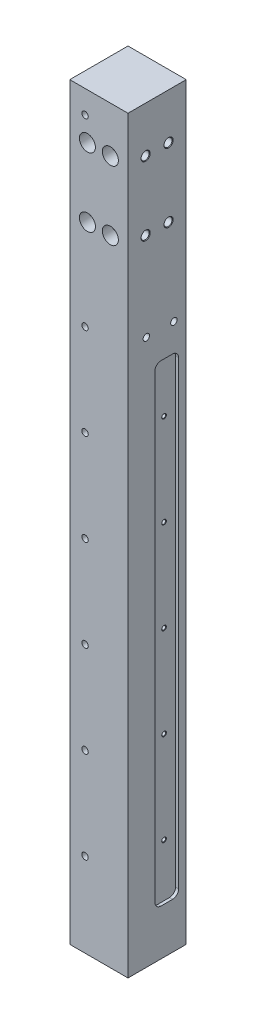
from build123d import *

# Parameters (mm, degrees)
SKETCH1_W                      = 38.1
SKETCH1_H                      = 38.1
BOSS_EXTRUDE1_DEPTH            = 490
CBORE_FOR_M5_SBHCS1_AT_2_COUNT = 2
CBORE_FOR_M5_SBHCS1_AT_2_PITCH = 15
CBORE_FOR_M5_SBHCS1_AT_3_COUNT = 2
CBORE_FOR_M5_SBHCS1_AT_3_PITCH = 45
CBORE_FOR_M5_SBHCS1_AT_4_COUNT = 2
CBORE_FOR_M5_SBHCS1_AT_4_PITCH = 47.434164903
M5X0_8_TAPPED_HOLE1_AT_2_COUNT = 2
M5X0_8_TAPPED_HOLE1_AT_2_PITCH = 60
M5X0_8_TAPPED_HOLE1_AT_3_COUNT = 2
M5X0_8_TAPPED_HOLE1_AT_3_PITCH = 120
M5X0_8_TAPPED_HOLE1_AT_4_COUNT = 2
M5X0_8_TAPPED_HOLE1_AT_4_PITCH = 180
M5X0_8_TAPPED_HOLE1_AT_5_COUNT = 2
M5X0_8_TAPPED_HOLE1_AT_5_PITCH = 240
M5X0_8_TAPPED_HOLE1_AT_6_COUNT = 2
M5X0_8_TAPPED_HOLE1_AT_6_PITCH = 300
M5X0_8_TAPPED_HOLE1_AT_7_COUNT = 2
M5X0_8_TAPPED_HOLE1_AT_7_PITCH = 360
M5X0_8_TAPPED_HOLE1_AT_8_COUNT = 2
M5X0_8_TAPPED_HOLE1_AT_8_PITCH = 420
M5X0_8_TAPPED_HOLE3_AT_2_COUNT = 2
M5X0_8_TAPPED_HOLE3_AT_2_PITCH = 18
SKETCH11_W                     = 15.5
SKETCH11_H                     = 309
CUT_EXTRUDE1_DEPTH             = 2
FILLET1_R                      = 4
M3X0_5_TAPPED_HOLE1_AT_2_COUNT = 2
M3X0_5_TAPPED_HOLE1_AT_2_PITCH = 60
M3X0_5_TAPPED_HOLE1_AT_3_COUNT = 2
M3X0_5_TAPPED_HOLE1_AT_3_PITCH = 120
M3X0_5_TAPPED_HOLE1_AT_4_COUNT = 2
M3X0_5_TAPPED_HOLE1_AT_4_PITCH = 180
M3X0_5_TAPPED_HOLE1_AT_5_COUNT = 2
M3X0_5_TAPPED_HOLE1_AT_5_PITCH = 240
FILLET1_OF_MIRROR2_R           = 4


with BuildPart() as part:
    # Sketch1 → Boss-Extrude1 (new body)
    with BuildSketch(Plane(origin=(0, 0, 0), x_dir=(1, 0, 0), z_dir=(0, 1, 0))):
        Rectangle(SKETCH1_W, SKETCH1_H)
    extrude(amount=BOSS_EXTRUDE1_DEPTH)

    # Sketch3 → CBORE for M5 SBHCS1 (revolve, cut)
    with BuildSketch(Plane(origin=(-19.05, 415, -7.5), x_dir=(0, 0, 1), z_dir=(0, 1, 0))):
        Polygon((0, 0), (0, 38.1), (3, 38.1), (2.65, 37.75), (2.65, 32.85), (5.25, 32.85), (5.25, 0), align=None)
    cbore_for_m5_sbhcs1 = revolve(axis=Axis((-25.4, 415, -7.5), (1, 0, 0)), mode=Mode.SUBTRACT)

    # CBORE for M5 SBHCS1 at 2: CBORE for M5 SBHCS1 ×2
    with Locations(*[(0, 0, i * CBORE_FOR_M5_SBHCS1_AT_2_PITCH) for i in range(1, CBORE_FOR_M5_SBHCS1_AT_2_COUNT)]):
        add(cbore_for_m5_sbhcs1, mode=Mode.SUBTRACT)

    # CBORE for M5 SBHCS1 at 3: CBORE for M5 SBHCS1 ×2
    with Locations(*[(0, i * CBORE_FOR_M5_SBHCS1_AT_3_PITCH, 0) for i in range(1, CBORE_FOR_M5_SBHCS1_AT_3_COUNT)]):
        add(cbore_for_m5_sbhcs1, mode=Mode.SUBTRACT)

    # CBORE for M5 SBHCS1 at 4: CBORE for M5 SBHCS1 ×2
    with Locations(*[Vector(0, 0.9486832980505138, 0.31622776601683833) * (i * CBORE_FOR_M5_SBHCS1_AT_4_PITCH) for i in range(1, CBORE_FOR_M5_SBHCS1_AT_4_COUNT)]):
        add(cbore_for_m5_sbhcs1, mode=Mode.SUBTRACT)

    # Sketch6 → M5x0.8 Tapped Hole1 (revolve, cut)
    with BuildSketch(Plane(origin=(-19.05, 475, 9.05), x_dir=(0, 0, 1), z_dir=(0, 1, 0))):
        Polygon((0, 0), (0, 9.6618073), (2.1, 8.4), (2.1, 0), align=None)
    m5x0_8_tapped_hole1 = revolve(axis=Axis((-25.4, 475, 9.05), (1, 0, 0)), mode=Mode.SUBTRACT)

    # M5x0.8 Tapped Hole1 at 2: M5x0.8 Tapped Hole1 ×2
    with Locations(*[(0, -i * M5X0_8_TAPPED_HOLE1_AT_2_PITCH, 0) for i in range(1, M5X0_8_TAPPED_HOLE1_AT_2_COUNT)]):
        add(m5x0_8_tapped_hole1, mode=Mode.SUBTRACT)

    # M5x0.8 Tapped Hole1 at 3: M5x0.8 Tapped Hole1 ×2
    with Locations(*[(0, -i * M5X0_8_TAPPED_HOLE1_AT_3_PITCH, 0) for i in range(1, M5X0_8_TAPPED_HOLE1_AT_3_COUNT)]):
        add(m5x0_8_tapped_hole1, mode=Mode.SUBTRACT)

    # M5x0.8 Tapped Hole1 at 4: M5x0.8 Tapped Hole1 ×2
    with Locations(*[(0, -i * M5X0_8_TAPPED_HOLE1_AT_4_PITCH, 0) for i in range(1, M5X0_8_TAPPED_HOLE1_AT_4_COUNT)]):
        add(m5x0_8_tapped_hole1, mode=Mode.SUBTRACT)

    # M5x0.8 Tapped Hole1 at 5: M5x0.8 Tapped Hole1 ×2
    with Locations(*[(0, -i * M5X0_8_TAPPED_HOLE1_AT_5_PITCH, 0) for i in range(1, M5X0_8_TAPPED_HOLE1_AT_5_COUNT)]):
        add(m5x0_8_tapped_hole1, mode=Mode.SUBTRACT)

    # M5x0.8 Tapped Hole1 at 6: M5x0.8 Tapped Hole1 ×2
    with Locations(*[(0, -i * M5X0_8_TAPPED_HOLE1_AT_6_PITCH, 0) for i in range(1, M5X0_8_TAPPED_HOLE1_AT_6_COUNT)]):
        add(m5x0_8_tapped_hole1, mode=Mode.SUBTRACT)

    # M5x0.8 Tapped Hole1 at 7: M5x0.8 Tapped Hole1 ×2
    with Locations(*[(0, -i * M5X0_8_TAPPED_HOLE1_AT_7_PITCH, 0) for i in range(1, M5X0_8_TAPPED_HOLE1_AT_7_COUNT)]):
        add(m5x0_8_tapped_hole1, mode=Mode.SUBTRACT)

    # M5x0.8 Tapped Hole1 at 8: M5x0.8 Tapped Hole1 ×2
    with Locations(*[(0, -i * M5X0_8_TAPPED_HOLE1_AT_8_PITCH, 0) for i in range(1, M5X0_8_TAPPED_HOLE1_AT_8_COUNT)]):
        add(m5x0_8_tapped_hole1, mode=Mode.SUBTRACT)

    # Sketch10 → M5x0.8 Tapped Hole3 (revolve, cut)
    with BuildSketch(Plane(origin=(19.05, 357, 7.05), x_dir=(0, 0, -1), z_dir=(0, 1, 0))):
        Polygon((0, 0), (0, 7.6618073), (2.1, 6.4), (2.1, 0), align=None)
    m5x0_8_tapped_hole3 = revolve(axis=Axis((25.4, 357, 7.05), (-1, 0, 0)), mode=Mode.SUBTRACT)

    # M5x0.8 Tapped Hole3 at 2: M5x0.8 Tapped Hole3 ×2
    with Locations(*[(0, 0, -i * M5X0_8_TAPPED_HOLE3_AT_2_PITCH) for i in range(1, M5X0_8_TAPPED_HOLE3_AT_2_COUNT)]):
        add(m5x0_8_tapped_hole3, mode=Mode.SUBTRACT)

    # Sketch11 → Cut-Extrude1 (cut)
    with BuildSketch(Plane(origin=(19.05, 0, 0), x_dir=(0, 0, -1), z_dir=(1, 0, 0))):
        with Locations((6.3, 184.5)):
            Rectangle(SKETCH11_W, SKETCH11_H)
    cut_extrude1 = extrude(amount=-CUT_EXTRUDE1_DEPTH, mode=Mode.SUBTRACT)

    # Fillet1
    fillet1_edges = [part.edges().sort_by_distance(p)[0] for p in [
        (18.05, 339, -14.05),
        (18.05, 30, -14.05),
        (18.05, 30, 1.45),
        (18.05, 339, 1.45),
    ]]
    fillet(fillet1_edges, radius=FILLET1_R)

    # Sketch13 → M3x0.5 Tapped Hole1 (revolve, cut)
    with BuildSketch(Plane(origin=(17.05, 64.5, -6.55), x_dir=(0, 0, -1), z_dir=(0, 1, 0))):
        Polygon((0, 0), (0, 8.251075774), (1.25, 7.5), (1.25, 0.275), (1.525, 0), align=None)
    m3x0_5_tapped_hole1 = revolve(axis=Axis((23.4, 64.5, -6.55), (-1, 0, 0)), mode=Mode.SUBTRACT)

    # M3x0.5 Tapped Hole1 at 2: M3x0.5 Tapped Hole1 ×2
    with Locations(*[(0, i * M3X0_5_TAPPED_HOLE1_AT_2_PITCH, 0) for i in range(1, M3X0_5_TAPPED_HOLE1_AT_2_COUNT)]):
        add(m3x0_5_tapped_hole1, mode=Mode.SUBTRACT)

    # M3x0.5 Tapped Hole1 at 3: M3x0.5 Tapped Hole1 ×2
    with Locations(*[(0, i * M3X0_5_TAPPED_HOLE1_AT_3_PITCH, 0) for i in range(1, M3X0_5_TAPPED_HOLE1_AT_3_COUNT)]):
        add(m3x0_5_tapped_hole1, mode=Mode.SUBTRACT)

    # M3x0.5 Tapped Hole1 at 4: M3x0.5 Tapped Hole1 ×2
    with Locations(*[(0, i * M3X0_5_TAPPED_HOLE1_AT_4_PITCH, 0) for i in range(1, M3X0_5_TAPPED_HOLE1_AT_4_COUNT)]):
        add(m3x0_5_tapped_hole1, mode=Mode.SUBTRACT)

    # M3x0.5 Tapped Hole1 at 5: M3x0.5 Tapped Hole1 ×2
    with Locations(*[(0, i * M3X0_5_TAPPED_HOLE1_AT_5_PITCH, 0) for i in range(1, M3X0_5_TAPPED_HOLE1_AT_5_COUNT)]):
        add(m3x0_5_tapped_hole1, mode=Mode.SUBTRACT)

    # Mirror2: CBORE for M5 SBHCS1, M5x0.8 Tapped Hole1, M5x0.8 Tapped Hole3, Cut-Extrude1, M3x0.5 Tapped Hole1 across plane
    add(cbore_for_m5_sbhcs1.mirror(Plane(origin=(0, 0, 0), x_dir=(-0.7071067811865475, 0, 0.7071067811865477), z_dir=(-0.7071067811865476, 0, -0.7071067811865475))), mode=Mode.SUBTRACT)
    add(m5x0_8_tapped_hole1.mirror(Plane(origin=(0, 0, 0), x_dir=(-0.7071067811865475, 0, 0.7071067811865477), z_dir=(-0.7071067811865476, 0, -0.7071067811865475))), mode=Mode.SUBTRACT)
    add(m5x0_8_tapped_hole3.mirror(Plane(origin=(0, 0, 0), x_dir=(-0.7071067811865475, 0, 0.7071067811865477), z_dir=(-0.7071067811865476, 0, -0.7071067811865475))), mode=Mode.SUBTRACT)
    add(cut_extrude1.mirror(Plane(origin=(0, 0, 0), x_dir=(-0.7071067811865475, 0, 0.7071067811865477), z_dir=(-0.7071067811865476, 0, -0.7071067811865475))), mode=Mode.SUBTRACT)
    add(m3x0_5_tapped_hole1.mirror(Plane(origin=(0, 0, 0), x_dir=(-0.7071067811865475, 0, 0.7071067811865477), z_dir=(-0.7071067811865476, 0, -0.7071067811865475))), mode=Mode.SUBTRACT)

    # Mirror2 copy 1 sketch → Mirror2 copy 1 (revolve, cut)
    with BuildSketch(Plane(origin=(-7.5, 415, 19.05), x_dir=(-1, 0, 0), z_dir=(0, 1, 0))):
        Polygon((0, 0), (0, -38.1), (3, -38.1), (2.65, -37.75), (2.65, -32.85), (5.25, -32.85), (5.25, 0), align=None)
    revolve(axis=Axis((-7.5, 415, 25.4), (0, 0, 1)), mode=Mode.SUBTRACT)

    # Mirror2 copy 2 sketch → Mirror2 copy 2 (revolve, cut)
    with BuildSketch(Plane(origin=(7.5, 460, 19.05), x_dir=(-1, 0, 0), z_dir=(0, 1, 0))):
        Polygon((0, 0), (0, -38.1), (3, -38.1), (2.65, -37.75), (2.65, -32.85), (5.25, -32.85), (5.25, 0), align=None)
    revolve(axis=Axis((7.5, 460, 25.4), (0, 0, 1)), mode=Mode.SUBTRACT)

    # Mirror2 copy 3 sketch → Mirror2 copy 3 (revolve, cut)
    with BuildSketch(Plane(origin=(-7.5, 460, 19.05), x_dir=(-1, 0, 0), z_dir=(0, 1, 0))):
        Polygon((0, 0), (0, -38.1), (3, -38.1), (2.65, -37.75), (2.65, -32.85), (5.25, -32.85), (5.25, 0), align=None)
    revolve(axis=Axis((-7.5, 460, 25.4), (0, 0, 1)), mode=Mode.SUBTRACT)

    # Mirror2 copy 4 sketch → Mirror2 copy 4 (revolve, cut)
    with BuildSketch(Plane(origin=(-9.05, 415, 19.05), x_dir=(-1, 0, 0), z_dir=(0, 1, 0))):
        Polygon((0, 0), (0, -9.6618073), (2.1, -8.4), (2.1, 0), align=None)
    revolve(axis=Axis((-9.05, 415, 25.4), (0, 0, 1)), mode=Mode.SUBTRACT)

    # Mirror2 copy 5 sketch → Mirror2 copy 5 (revolve, cut)
    with BuildSketch(Plane(origin=(-9.05, 355, 19.05), x_dir=(-1, 0, 0), z_dir=(0, 1, 0))):
        Polygon((0, 0), (0, -9.6618073), (2.1, -8.4), (2.1, 0), align=None)
    revolve(axis=Axis((-9.05, 355, 25.4), (0, 0, 1)), mode=Mode.SUBTRACT)

    # Mirror2 copy 6 sketch → Mirror2 copy 6 (revolve, cut)
    with BuildSketch(Plane(origin=(-9.05, 295, 19.05), x_dir=(-1, 0, 0), z_dir=(0, 1, 0))):
        Polygon((0, 0), (0, -9.6618073), (2.1, -8.4), (2.1, 0), align=None)
    revolve(axis=Axis((-9.05, 295, 25.4), (0, 0, 1)), mode=Mode.SUBTRACT)

    # Mirror2 copy 7 sketch → Mirror2 copy 7 (revolve, cut)
    with BuildSketch(Plane(origin=(-9.05, 235, 19.05), x_dir=(-1, 0, 0), z_dir=(0, 1, 0))):
        Polygon((0, 0), (0, -9.6618073), (2.1, -8.4), (2.1, 0), align=None)
    revolve(axis=Axis((-9.05, 235, 25.4), (0, 0, 1)), mode=Mode.SUBTRACT)

    # Mirror2 copy 8 sketch → Mirror2 copy 8 (revolve, cut)
    with BuildSketch(Plane(origin=(-9.05, 175, 19.05), x_dir=(-1, 0, 0), z_dir=(0, 1, 0))):
        Polygon((0, 0), (0, -9.6618073), (2.1, -8.4), (2.1, 0), align=None)
    revolve(axis=Axis((-9.05, 175, 25.4), (0, 0, 1)), mode=Mode.SUBTRACT)

    # Mirror2 copy 9 sketch → Mirror2 copy 9 (revolve, cut)
    with BuildSketch(Plane(origin=(-9.05, 115, 19.05), x_dir=(-1, 0, 0), z_dir=(0, 1, 0))):
        Polygon((0, 0), (0, -9.6618073), (2.1, -8.4), (2.1, 0), align=None)
    revolve(axis=Axis((-9.05, 115, 25.4), (0, 0, 1)), mode=Mode.SUBTRACT)

    # Mirror2 copy 10 sketch → Mirror2 copy 10 (revolve, cut)
    with BuildSketch(Plane(origin=(-9.05, 55, 19.05), x_dir=(-1, 0, 0), z_dir=(0, 1, 0))):
        Polygon((0, 0), (0, -9.6618073), (2.1, -8.4), (2.1, 0), align=None)
    revolve(axis=Axis((-9.05, 55, 25.4), (0, 0, 1)), mode=Mode.SUBTRACT)

    # Mirror2 copy 11 sketch → Mirror2 copy 11 (revolve, cut)
    with BuildSketch(Plane(origin=(10.95, 357, -19.05), x_dir=(1, 0, 0), z_dir=(0, 1, 0))):
        Polygon((0, 0), (0, -7.6618073), (2.1, -6.4), (2.1, 0), align=None)
    revolve(axis=Axis((10.95, 357, -25.4), (0, 0, -1)), mode=Mode.SUBTRACT)

    # Mirror2 copy 12 sketch → Mirror2 copy 12 (revolve, cut)
    with BuildSketch(Plane(origin=(6.55, 124.5, -17.05), x_dir=(1, 0, 0), z_dir=(0, 1, 0))):
        Polygon((0, 0), (0, -8.251075774), (1.25, -7.5), (1.25, -0.275), (1.525, 0), align=None)
    revolve(axis=Axis((6.55, 124.5, -23.4), (0, 0, -1)), mode=Mode.SUBTRACT)

    # Mirror2 copy 13 sketch → Mirror2 copy 13 (revolve, cut)
    with BuildSketch(Plane(origin=(6.55, 184.5, -17.05), x_dir=(1, 0, 0), z_dir=(0, 1, 0))):
        Polygon((0, 0), (0, -8.251075774), (1.25, -7.5), (1.25, -0.275), (1.525, 0), align=None)
    revolve(axis=Axis((6.55, 184.5, -23.4), (0, 0, -1)), mode=Mode.SUBTRACT)

    # Mirror2 copy 14 sketch → Mirror2 copy 14 (revolve, cut)
    with BuildSketch(Plane(origin=(6.55, 244.5, -17.05), x_dir=(1, 0, 0), z_dir=(0, 1, 0))):
        Polygon((0, 0), (0, -8.251075774), (1.25, -7.5), (1.25, -0.275), (1.525, 0), align=None)
    revolve(axis=Axis((6.55, 244.5, -23.4), (0, 0, -1)), mode=Mode.SUBTRACT)

    # Mirror2 copy 15 sketch → Mirror2 copy 15 (revolve, cut)
    with BuildSketch(Plane(origin=(6.55, 304.5, -17.05), x_dir=(1, 0, 0), z_dir=(0, 1, 0))):
        Polygon((0, 0), (0, -8.251075774), (1.25, -7.5), (1.25, -0.275), (1.525, 0), align=None)
    revolve(axis=Axis((6.55, 304.5, -23.4), (0, 0, -1)), mode=Mode.SUBTRACT)

    # Fillet1 of Mirror2
    fillet1_of_mirror2_edges = [part.edges().sort_by_distance(p)[0] for p in [
        (14.05, 339, -18.05),
        (14.05, 30, -18.05),
        (-1.45, 30, -18.05),
        (-1.45, 339, -18.05),
    ]]
    fillet(fillet1_of_mirror2_edges, radius=FILLET1_OF_MIRROR2_R)


solid = part.part
